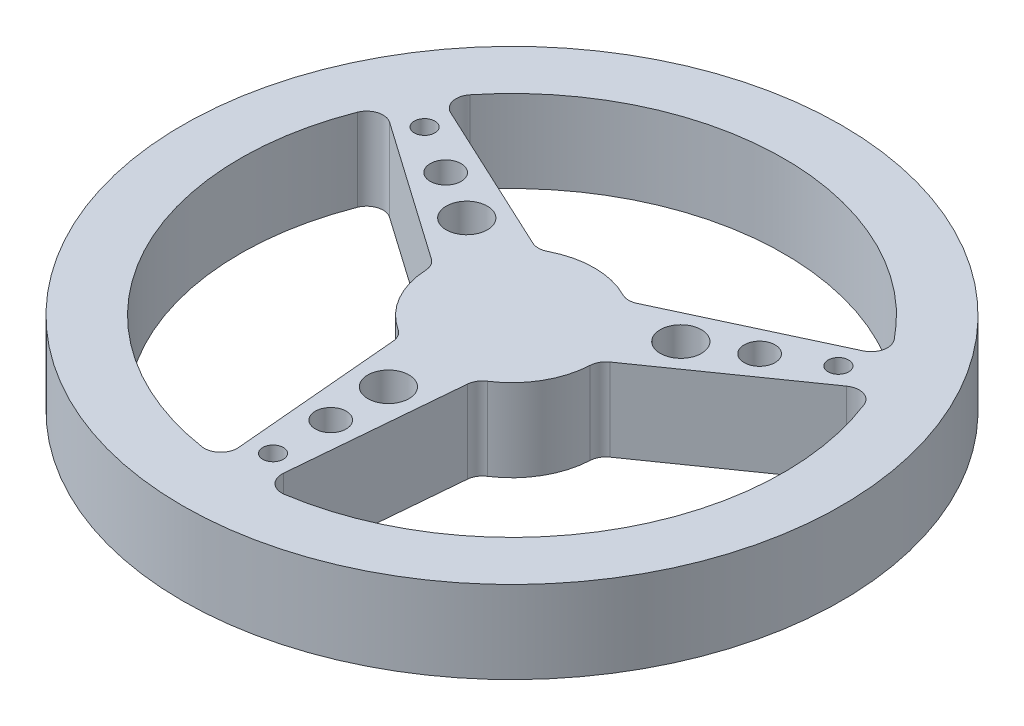
from build123d import *

# Parameters (mm, degrees)
SKETCH1_R           = 50.8
BOSS_EXTRUDE1_DEPTH = 12.7
SKETCH2_R           = 3.175
SKETCH2_R_2         = 2.38125
SKETCH2_R_3         = 1.5875
CUT_EXTRUDE1_DEPTH  = 73.955945611
FILLET1_R           = 2.54


with BuildPart() as part:
    # Sketch1 → Boss-Extrude1 (new body)
    with BuildSketch(Plane(origin=(0, 0, 0), x_dir=(1, 0, 0), z_dir=(0, 1, 0))):
        Circle(SKETCH1_R)
    extrude(amount=BOSS_EXTRUDE1_DEPTH)

    # Sketch2 → Cut-Extrude1 (cut, through all)
    with BuildSketch(Plane(origin=(0, 12.7, 0), x_dir=(1, 0, 0), z_dir=(0, 1, 0))):
        with BuildLine():
            Line((5.844661521, -11.275190983), (3.175, -41.789561795))
            ThreePointArc((3.175, -41.789561795), (36.295124673, -20.955), (37.778322127, 18.14515024))
            Line((37.778322127, 18.14515024), (12.686932584, 0.575970138))
            ThreePointArc((12.686932584, 0.575970138), (10.998522628, -6.35), (5.844661521, -11.275190983))
        make_face()
        with BuildLine():
            ThreePointArc((-37.778322127, 18.14515024), (-36.295124673, -20.955), (-3.175, -41.789561795))
            Line((-3.175, -41.789561795), (-5.844661521, -11.275190983))
            ThreePointArc((-5.844661521, -11.275190983), (-10.998522628, -6.35), (-12.686932584, 0.575970138))
            Line((-12.686932584, 0.575970138), (-37.778322127, 18.14515024))
        make_face()
        with BuildLine():
            ThreePointArc((34.603322127, 23.644411554), (0, 41.91), (-34.603322127, 23.644411554))
            Line((-34.603322127, 23.644411554), (-6.842271064, 10.699220845))
            ThreePointArc((-6.842271064, 10.699220845), (-3.564400038, 12.189546848), (0, 12.7))
            ThreePointArc((0, 12.7), (3.564400038, 12.189546848), (6.842271064, 10.699220845))
            Line((6.842271064, 10.699220845), (34.603322127, 23.644411554))
        make_face()
        with Locations((0, -19.05)):
            Circle(SKETCH2_R)
        with Locations((0, -27.94)):
            Circle(SKETCH2_R_2)
        with Locations((0, -36.83)):
            Circle(SKETCH2_R_3)
        with Locations((-16.497783942, 9.525)):
            Circle(SKETCH2_R)
        with Locations((-24.196749782, 13.97)):
            Circle(SKETCH2_R_2)
        with Locations((-31.895715621, 18.415)):
            Circle(SKETCH2_R_3)
        with Locations((16.497783942, 9.525)):
            Circle(SKETCH2_R)
        with Locations((24.196749782, 13.97)):
            Circle(SKETCH2_R_2)
        with Locations((31.895715621, 18.415)):
            Circle(SKETCH2_R_3)
    extrude(amount=-CUT_EXTRUDE1_DEPTH, mode=Mode.SUBTRACT)

    # Fillet1
    fillet1_edges = [part.edges().sort_by_distance(p)[0] for p in [
        (37.778322127, 6.35, -18.14515024),
        (34.603322127, 6.35, -23.644411554),
        (-6.842271064, 6.35, -10.699220845),
        (6.842271064, 6.35, -10.699220845),
        (12.686932584, 6.35, -0.575970138),
        (-12.686932584, 6.35, -0.575970138),
        (-5.844661521, 6.35, 11.275190983),
        (-3.175, 6.35, 41.789561795),
        (3.175, 6.35, 41.789561795),
        (5.844661521, 6.35, 11.275190983),
        (-34.603322127, 6.35, -23.644411554),
        (-37.778322127, 6.35, -18.14515024),
    ]]
    fillet(fillet1_edges, radius=FILLET1_R)


solid = part.part
